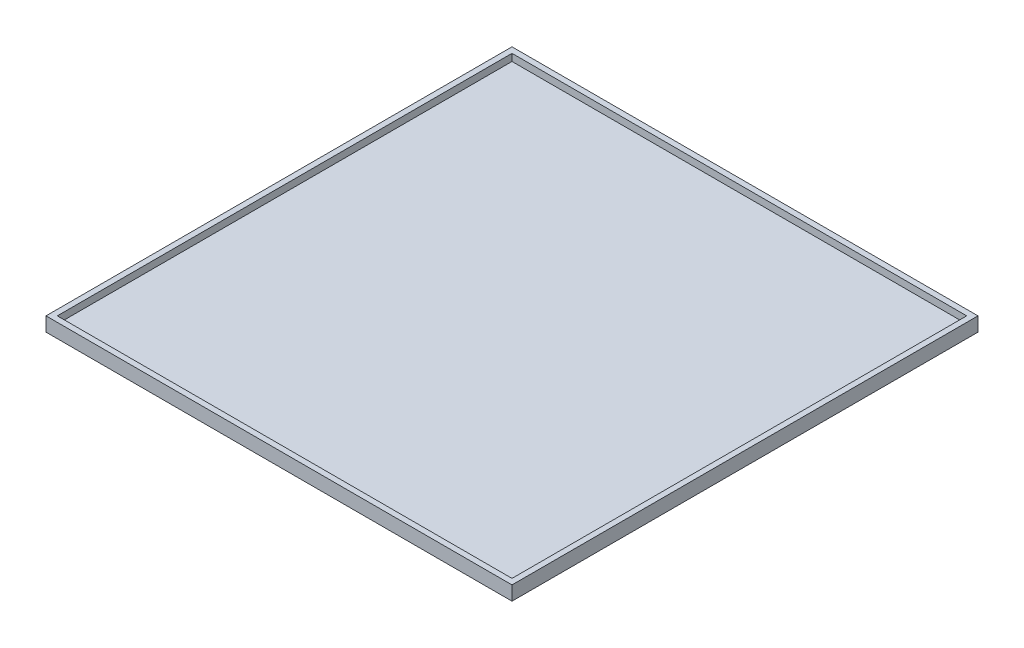
from build123d import *

# Parameters (mm, degrees)
SKETCH1_W           = 209.55
SKETCH1_H           = 209.55
BOSS_EXTRUDE1_DEPTH = 6.35
SKETCH2_W           = 204.47
SKETCH2_H           = 204.47
CUT_EXTRUDE1_DEPTH  = 3.175


with BuildPart() as part:
    # Sketch1 → Boss-Extrude1 (new body)
    with BuildSketch(Plane(origin=(0, 0, 0), x_dir=(1, 0, 0), z_dir=(0, 1, 0))):
        Rectangle(SKETCH1_W, SKETCH1_H)
    extrude(amount=BOSS_EXTRUDE1_DEPTH)

    # Sketch2 → Cut-Extrude1 (cut)
    with BuildSketch(Plane(origin=(0, 6.35, 0), x_dir=(1, 0, 0), z_dir=(0, 1, 0))):
        Rectangle(SKETCH2_W, SKETCH2_H)
    extrude(amount=-CUT_EXTRUDE1_DEPTH, mode=Mode.SUBTRACT)


solid = part.part
